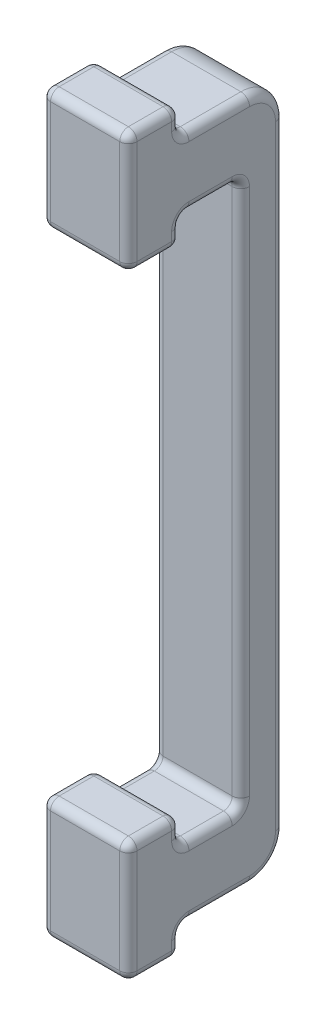
from build123d import *

# Parameters (mm, degrees)
BOSS_EXTRUDE1_DEPTH = 10
FILLET1_R           = 1


with BuildPart() as part:
    # Sketch1 → Boss-Extrude1 (new body)
    with BuildSketch(Plane(origin=(0, 0, 0), x_dir=(0, 0, -1), z_dir=(1, 0, 0))):
        with BuildLine():
            Line((1, 0), (5, 0))
            ThreePointArc((5, 0), (5.707106781, 0.292893219), (6, 1))
            Line((6, 1), (6, 2))
            ThreePointArc((6, 2), (6.292893219, 2.707106781), (7, 3))
            Line((7, 3), (13, 3))
            Line((13, 3), (14, 3))
            ThreePointArc((14, 3), (16.828427125, 4.171572875), (18, 7))
            Line((18, 7), (18, 78))
            ThreePointArc((18, 78), (16.828427125, 80.828427125), (14, 82))
            Line((14, 82), (13, 82))
            Line((13, 82), (7, 82))
            ThreePointArc((7, 82), (6.292893219, 82.292893219), (6, 83))
            Line((6, 83), (6, 84))
            ThreePointArc((6, 84), (5.707106781, 84.707106781), (5, 85))
            Line((5, 85), (1, 85))
            ThreePointArc((1, 85), (0.292893219, 84.707106781), (0, 84))
            Line((0, 84), (0, 72))
            ThreePointArc((0, 72), (0.292893219, 71.292893219), (1, 71))
            Line((1, 71), (5, 71))
            ThreePointArc((5, 71), (5.707106781, 71.292893219), (6, 72))
            Line((6, 72), (6, 73))
            ThreePointArc((6, 73), (6.292893219, 73.707106781), (7, 74))
            Line((7, 74), (12, 74))
            ThreePointArc((12, 74), (12.707106781, 73.707106781), (13, 73))
            Line((13, 73), (13, 12))
            ThreePointArc((13, 12), (12.707106781, 11.292893219), (12, 11))
            Line((12, 11), (7, 11))
            ThreePointArc((7, 11), (6.292893219, 11.292893219), (6, 12))
            Line((6, 12), (6, 13))
            ThreePointArc((6, 13), (5.707106781, 13.707106781), (5, 14))
            Line((5, 14), (1, 14))
            ThreePointArc((1, 14), (0.292893219, 13.707106781), (0, 13))
            Line((0, 13), (0, 1))
            ThreePointArc((0, 1), (0.292893219, 0.292893219), (1, 0))
        make_face()
    extrude(amount=BOSS_EXTRUDE1_DEPTH)

    # Fillet1
    fillet1_edges = [part.edges().sort_by_distance(p)[0] for p in [
        (10, 13.707106781, -5.707106781),
        (10, 14, -3),
        (10, 13.707106781, -0.292893219),
        (10, 7, 0),
        (10, 0.292893219, -0.292893219),
        (10, 0, -3),
        (10, 0.292893219, -5.707106781),
        (10, 1.5, -6),
        (10, 42.5, -18),
        (10, 2.707106781, -6.292893219),
        (10, 80.828427125, -16.828427125),
        (10, 82, -10.5),
        (10, 82.292893219, -6.292893219),
        (0, 3, -10.5),
        (0, 2.707106781, -6.292893219),
        (0, 1.5, -6),
        (10, 83.5, -6),
        (0, 0.292893219, -5.707106781),
        (0, 0, -3),
        (0, 0.292893219, -0.292893219),
        (0, 7, 0),
        (0, 13.707106781, -0.292893219),
        (0, 14, -3),
        (0, 13.707106781, -5.707106781),
        (0, 12.5, -6),
        (0, 11.292893219, -6.292893219),
        (0, 11, -9.5),
        (10, 84.707106781, -5.707106781),
        (0, 11.292893219, -12.707106781),
        (0, 42.5, -13),
        (0, 73.707106781, -12.707106781),
        (0, 74, -9.5),
        (0, 73.707106781, -6.292893219),
        (0, 72.5, -6),
        (0, 71.292893219, -5.707106781),
        (0, 71, -3),
        (0, 71.292893219, -0.292893219),
        (0, 78, 0),
        (10, 85, -3),
        (0, 84.707106781, -0.292893219),
        (0, 85, -3),
        (0, 84.707106781, -5.707106781),
        (0, 83.5, -6),
        (0, 82.292893219, -6.292893219),
        (0, 82, -10.5),
        (0, 80.828427125, -16.828427125),
        (0, 42.5, -18),
        (0, 4.171572875, -16.828427125),
        (10, 84.707106781, -0.292893219),
        (10, 78, 0),
        (10, 3, -10.5),
        (10, 71.292893219, -0.292893219),
        (10, 71, -3),
        (10, 71.292893219, -5.707106781),
        (10, 72.5, -6),
        (10, 73.707106781, -6.292893219),
        (10, 74, -9.5),
        (10, 73.707106781, -12.707106781),
        (10, 42.5, -13),
        (10, 11.292893219, -12.707106781),
        (10, 11, -9.5),
        (10, 4.171572875, -16.828427125),
        (10, 11.292893219, -6.292893219),
        (10, 12.5, -6),
    ]]
    fillet(fillet1_edges, radius=FILLET1_R)


solid = part.part
